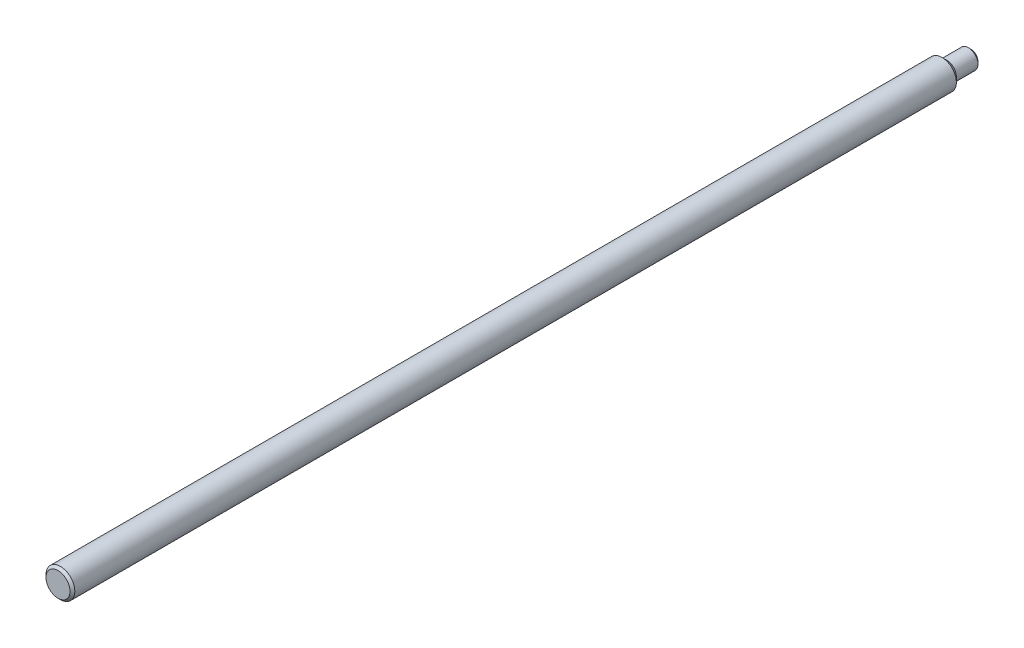
from build123d import *

# Parameters (mm, degrees)
SCHIZZO1_R                   = 6
ESTRUSIONE_ESTRUSIONE1_DEPTH = 380
SMUSSO1_SIZE                 = 1


with BuildPart() as part:
    # Schizzo1 → Estrusione-Estrusione1 (new body)
    with BuildSketch(Plane.XY):
        Circle(SCHIZZO1_R)
    extrude(amount=ESTRUSIONE_ESTRUSIONE1_DEPTH)

    # Schizzo2 → Taglia-Rivoluzione1 (revolve, cut)
    with BuildSketch(Plane(origin=(0, 0, 0), x_dir=(1, 0, 0), z_dir=(0, 1, 0))):
        Polygon((-4, -10), (-6, -12), (-6, 0), (-4, 0), align=None)
    revolve(axis=Axis((0, 0, -1.898721367), (0, 0, 1)), mode=Mode.SUBTRACT)

    # Smusso1
    smusso1_edges = [part.edges().sort_by_distance(p)[0] for p in [
        (-6, 0, 380),
        (4, 0, 0),
    ]]
    chamfer(smusso1_edges, length=SMUSSO1_SIZE)


solid = part.part
